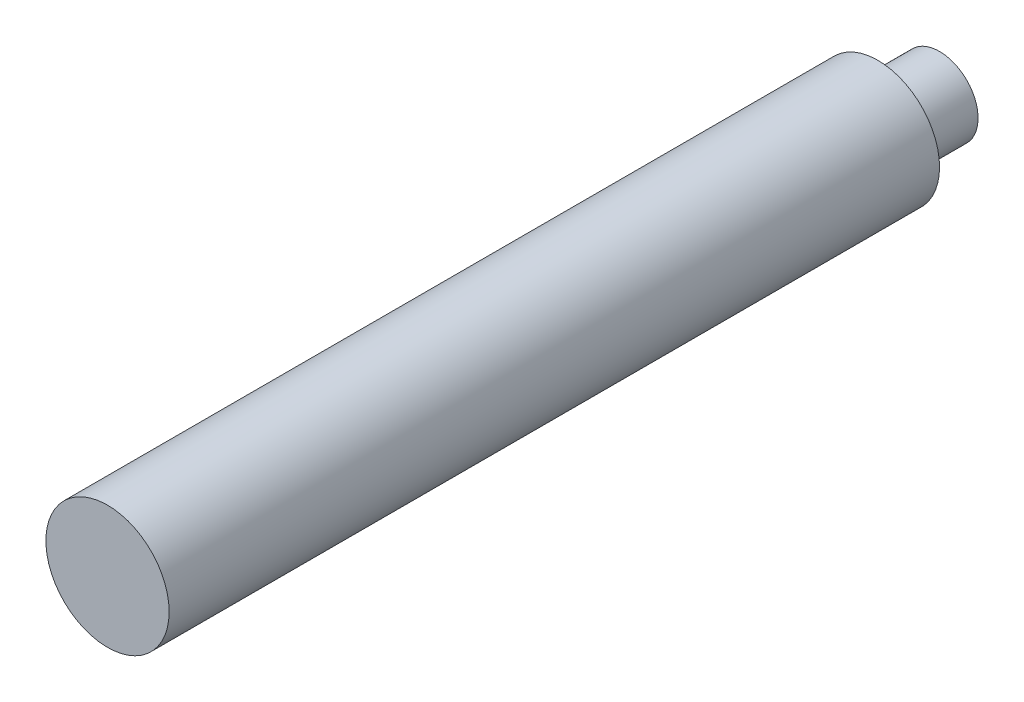
from build123d import *

# Parameters (mm, degrees)
SKETCH1_R           = 5.08
BOSS_EXTRUDE1_DEPTH = 63.5
SKETCH2_R           = 3.175
BOSS_EXTRUDE2_DEPTH = 5.08


with BuildPart() as part:
    # Sketch1 → Boss-Extrude1 (new body)
    with BuildSketch(Plane.XY):
        Circle(SKETCH1_R)
    extrude(amount=BOSS_EXTRUDE1_DEPTH)

    # Sketch2 → Boss-Extrude2 (add)
    with BuildSketch(Plane(origin=(0, 0, 0), x_dir=(-1, 0, 0), z_dir=(0, 0, -1))):
        Circle(SKETCH2_R)
    extrude(amount=BOSS_EXTRUDE2_DEPTH)


solid = part.part
